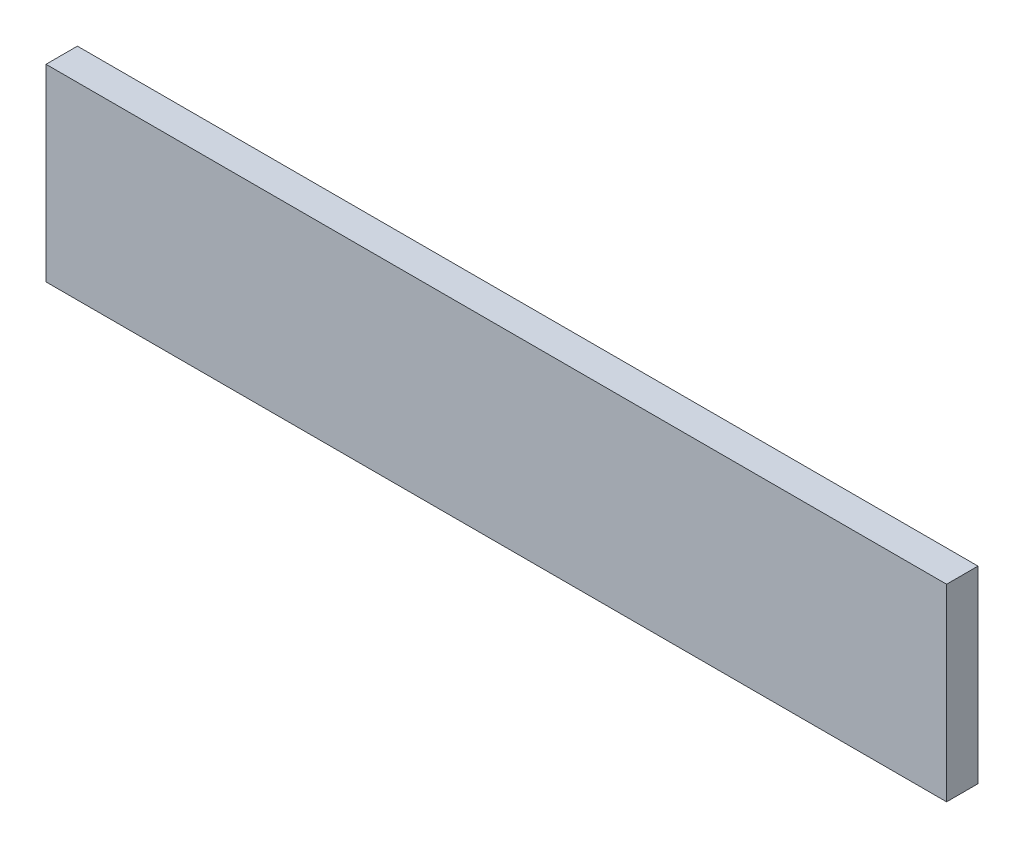
from build123d import *

# Parameters (mm, degrees)
SKETCH1_W           = 86
SKETCH1_H           = 18
BOSS_EXTRUDE1_DEPTH = 3


with BuildPart() as part:
    # Sketch1 → Boss-Extrude1 (new body)
    with BuildSketch(Plane.XY):
        Rectangle(SKETCH1_W, SKETCH1_H)
    extrude(amount=BOSS_EXTRUDE1_DEPTH)


solid = part.part
